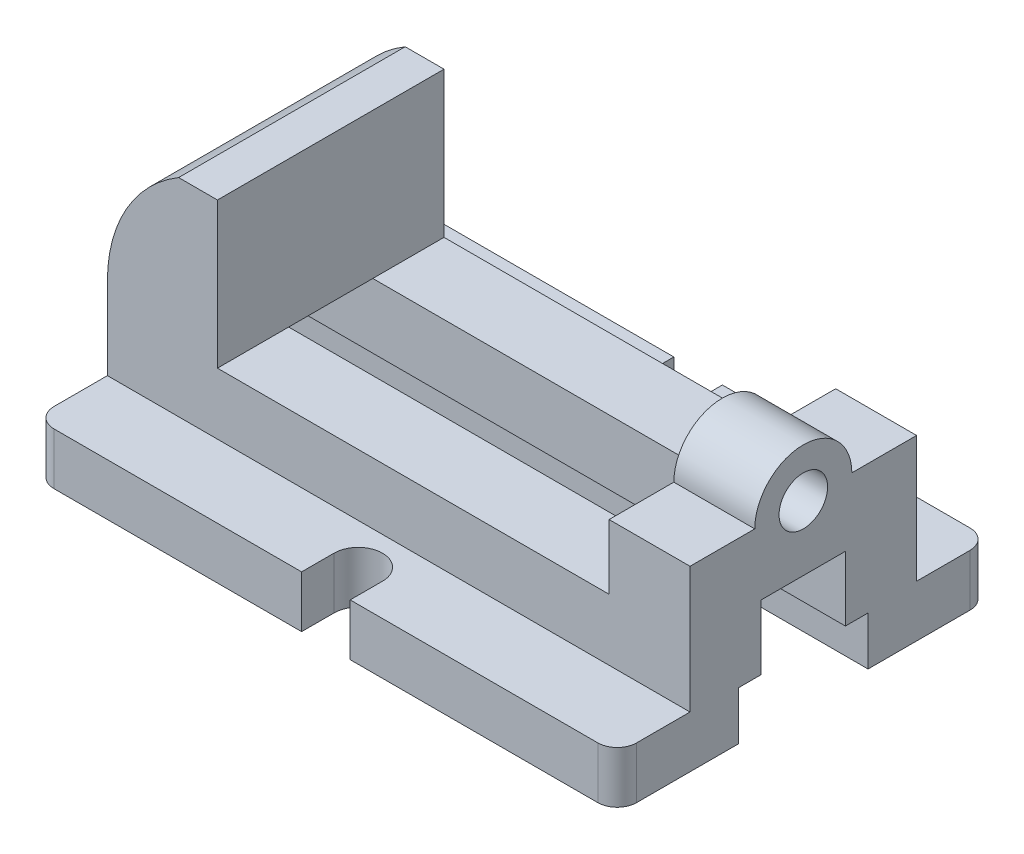
from build123d import *

# Parameters (mm, degrees)
BOSS_EXTRUDE1_DEPTH   = 90
BOSS_EXTRUDE1_2_DEPTH = 90
SKETCH2_R             = 7.5
BOSS_EXTRUDE2_DEPTH   = 25
BOSS_EXTRUDE3_START   = -70
BOSS_EXTRUDE3_DEPTH   = 70
FILLET1_R             = 6
CUT_EXTRUDE1_DEPTH    = 124.743686708


with BuildPart() as part:
    # Sketch1 → Boss-Extrude1 (new, symmetric)
    with BuildSketch(Plane(origin=(0, 0, 0), x_dir=(0, 0, -1), z_dir=(1, 0, 0))):
        Polygon((13, 17.5), (35, 17.5), (35, -1.5), (57.5, -1.5), (57.5, -17.5), (20, -17.5), (20, -2.5), (13, -2.5), align=None)
    extrude(amount=BOSS_EXTRUDE1_DEPTH, both=True)



with BuildPart() as body_2:
    # Sketch1 → Boss-Extrude1 2 (new, symmetric)
    with BuildSketch(Plane(origin=(0, 0, 0), x_dir=(0, 0, -1), z_dir=(1, 0, 0))):
        Polygon((-13, -2.5), (-13, 17.5), (-35, 17.5), (-35, -1.5), (-57.5, -1.5), (-57.5, -17.5), (-20, -17.5), (-20, -2.5), align=None)
    extrude(amount=BOSS_EXTRUDE1_2_DEPTH, both=True)


with BuildPart() as part_1:
    add(part.part)

    add(body_2.part)  # Boss-Extrude2 merges body 2
    # Sketch2 → Boss-Extrude2 (add)
    with BuildSketch(Plane(origin=(90, 0, 0), x_dir=(0, 0, -1), z_dir=(1, 0, 0))):
        with BuildLine():
            Line((35, 17.5), (-35, 17.5))
            Line((-35, 17.5), (-35, 37.5))
            Line((-35, 37.5), (-15, 37.5))
            ThreePointArc((-15, 37.5), (0, 52.5), (15, 37.5))
            Line((15, 37.5), (35, 37.5))
            Line((35, 37.5), (35, 17.5))
        make_face()
        with Locations((0, 37.5)):
            Circle(SKETCH2_R, mode=Mode.SUBTRACT)
    extrude(amount=-BOSS_EXTRUDE2_DEPTH)

    # Sketch3 → Boss-Extrude3 (add)
    with BuildSketch(Plane(origin=(0, 0, -35), x_dir=(-1, 0, 0), z_dir=(0, 0, -1)).offset(BOSS_EXTRUDE3_START)):
        with BuildLine():
            Line((90, 17.5), (56, 17.5))
            Line((56, 17.5), (56, 62.5))
            Line((56, 62.5), (68, 62.5))
            ThreePointArc((68, 62.5), (84.115214431, 46.07043625), (90, 23.821840788))
            Line((90, 23.821840788), (90, 17.5))
        make_face()
    extrude(amount=BOSS_EXTRUDE3_DEPTH)

    # Fillet1
    fillet1_edges = [part_1.edges().sort_by_distance(p)[0] for p in [
        (90, -9.5, -57.5),
        (-90, -9.5, 57.5),
        (90, -9.5, 57.5),
        (-90, -9.5, -57.5),
    ]]
    fillet(fillet1_edges, radius=FILLET1_R)

    # Sketch4 → Cut-Extrude1 (cut, through all)
    with BuildSketch(Plane(origin=(0, 0, 0), x_dir=(1, 0, 0), z_dir=(0, 1, 0))):
        with BuildLine():
            Line((7.5, 67.5), (7.5, 47.5))
            ThreePointArc((7.5, 47.5), (0, 40), (-7.5, 47.5))
            Line((-7.5, 47.5), (-7.5, 67.5))
            ThreePointArc((-7.5, 67.5), (0, 75), (7.5, 67.5))
        make_face()
        with BuildLine():
            Line((-7.5, -67.5), (-7.5, -47.5))
            ThreePointArc((-7.5, -47.5), (0, -40), (7.5, -47.5))
            Line((7.5, -47.5), (7.5, -67.5))
            ThreePointArc((7.5, -67.5), (0, -75), (-7.5, -67.5))
        make_face()
    extrude(amount=-CUT_EXTRUDE1_DEPTH, mode=Mode.SUBTRACT)


solid = part_1.part
